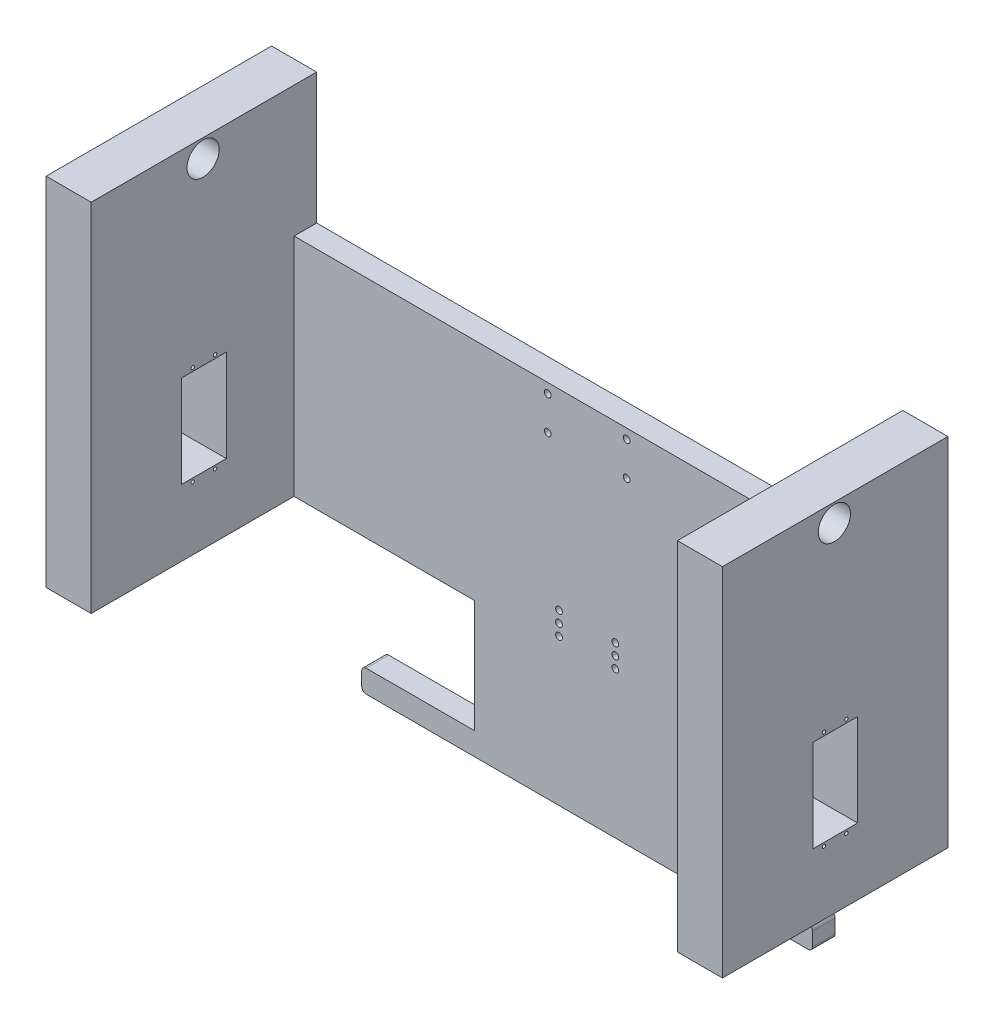
from build123d import *

# Parameters (mm, degrees)
SKETCH1_W           = 300
SKETCH1_H           = 100
BOSS_EXTRUDE1_DEPTH = 10
SKETCH2_W           = 20
SKETCH2_H           = 100
BOSS_EXTRUDE2_DEPTH = 90
SKETCH3_W           = 19.9
SKETCH3_H           = 40.9
SKETCH3_R           = 0.75
CUT_EXTRUDE1_DEPTH  = 321.156211872
SKETCH4_W           = 100
SKETCH4_H           = 10
BOSS_EXTRUDE4_DEPTH = 60
SKETCH6_W           = 200
SKETCH6_H           = 10
BOSS_EXTRUDE5_DEPTH = 10
FILLET1_R           = 2
SKETCH8_W           = 20
SKETCH8_H           = 100
BOSS_EXTRUDE7_DEPTH = 50
BOSS_EXTRUDE9_DEPTH = 300
SKETCH12_W          = 260
SKETCH12_H          = 100
CUT_EXTRUDE4_DEPTH  = 20
SKETCH13_R          = 1.5
CUT_EXTRUDE5_DEPTH  = 207.639783198
SKETCH14_R          = 7.15
CUT_EXTRUDE7_DEPTH  = 335.813380856
SKETCH15_R          = 1.5
CUT_EXTRUDE8_DEPTH  = 212.187120819


with BuildPart() as part:
    # Sketch1 → Boss-Extrude1 (new body)
    with BuildSketch(Plane.XY):
        Rectangle(SKETCH1_W, SKETCH1_H)
    extrude(amount=BOSS_EXTRUDE1_DEPTH)

    # Sketch2 → Boss-Extrude2 (add)
    with BuildSketch(Plane.XY.offset(10)):
        with Locations((-140, 0)):
            Rectangle(SKETCH2_W, SKETCH2_H)
        with Locations((140, 0)):
            Rectangle(SKETCH2_W, SKETCH2_H)
    extrude(amount=BOSS_EXTRUDE2_DEPTH)

    # Sketch3 → Cut-Extrude1 (cut, through all)
    with BuildSketch(Plane.ZY.offset(150)):
        with Locations((50, 0)):
            Rectangle(SKETCH3_W, SKETCH3_H)
        with Locations((45.025, 21.95)):
            Circle(SKETCH3_R)
        with Locations((54.975, 21.95)):
            Circle(SKETCH3_R)
        with Locations((45.025, -21.95)):
            Circle(SKETCH3_R)
        with Locations((54.975, -21.95)):
            Circle(SKETCH3_R)
    extrude(amount=-CUT_EXTRUDE1_DEPTH, mode=Mode.SUBTRACT)

    # Sketch4 → Boss-Extrude4 (add)
    with BuildSketch(Plane.XZ.offset(50)):
        with Locations((0, 5)):
            Rectangle(SKETCH4_W, SKETCH4_H)
    extrude(amount=BOSS_EXTRUDE4_DEPTH)

    # Sketch6 → Boss-Extrude5 (add)
    with BuildSketch(Plane.XZ.offset(110)):
        with Locations((0, 5)):
            Rectangle(SKETCH6_W, SKETCH6_H)
    extrude(amount=-BOSS_EXTRUDE5_DEPTH)

    # Fillet1
    fillet1_edges = [part.edges().sort_by_distance(p)[0] for p in [
        (-100, -110, 5),
        (100, -100, 5),
        (-100, -100, 5),
        (100, -110, 5),
    ]]
    fillet(fillet1_edges, radius=FILLET1_R)

    # Sketch8 → Boss-Extrude7 (add)
    with BuildSketch(Plane(origin=(0, 50, 0), x_dir=(1, 0, 0), z_dir=(0, 1, 0))):
        with Locations((-140, -50)):
            Rectangle(SKETCH8_W, SKETCH8_H)
        with Locations((140, -50)):
            Rectangle(SKETCH8_W, SKETCH8_H)
    extrude(amount=BOSS_EXTRUDE7_DEPTH)

    # Sketch9 → Boss-Extrude9 (add, through all)
    with BuildSketch(Plane.ZY.offset(150)):
        with BuildLine():
            Line((0, 108), (0, 102.5))
            Line((0, 102.5), (48.5, 102.5))
            ThreePointArc((48.5, 102.5), (50, 104), (51.5, 102.5))
            Line((51.5, 102.5), (100, 102.5))
            Line((100, 102.5), (100, 108))
            Line((100, 108), (0, 108))
        make_face()
        with BuildLine():
            Line((0, 102.5), (0, 100))
            Line((0, 100), (100, 100))
            Line((100, 100), (100, 102.5))
            Line((100, 102.5), (51.5, 102.5))
            ThreePointArc((51.5, 102.5), (50, 101), (48.5, 102.5))
            Line((48.5, 102.5), (0, 102.5))
        make_face()
    extrude(amount=-BOSS_EXTRUDE9_DEPTH)

    # Sketch12 → Cut-Extrude4 (cut)
    with BuildSketch(Plane.XZ.offset(-100)):
        with Locations((0, 50)):
            Rectangle(SKETCH12_W, SKETCH12_H)
    extrude(amount=-CUT_EXTRUDE4_DEPTH, mode=Mode.SUBTRACT)

    # Sketch13 → Cut-Extrude5 (cut, through all)
    with BuildSketch(Plane.XY.offset(10)):
        with Locations((12.5, -35)):
            Circle(SKETCH13_R)
        with Locations((12.5, -40)):
            Circle(SKETCH13_R)
        with Locations((12.5, -45)):
            Circle(SKETCH13_R)
        with Locations((-12.5, -35)):
            Circle(SKETCH13_R)
        with Locations((-12.5, -40)):
            Circle(SKETCH13_R)
        with Locations((-12.5, -45)):
            Circle(SKETCH13_R)
    extrude(amount=-CUT_EXTRUDE5_DEPTH, mode=Mode.SUBTRACT)

    # Sketch14 → Cut-Extrude7 (cut, through all)
    with BuildSketch(Plane(origin=(150, 0, 0), x_dir=(0, 0, -1), z_dir=(1, 0, 0))):
        with Locations(Location((-50.372507489, 99.940398802, 0), (0, 0, 90))):
            Circle(SKETCH14_R)
    extrude(amount=-CUT_EXTRUDE7_DEPTH, mode=Mode.SUBTRACT)

    # Sketch15 → Cut-Extrude8 (cut, through all)
    with BuildSketch(Plane(origin=(0, 0, 0), x_dir=(-1, 0, 0), z_dir=(0, 0, -1))):
        with Locations((-17.5, 45.680401999)):
            Circle(SKETCH15_R)
        with Locations((17.5, 45.680401999)):
            Circle(SKETCH15_R)
        with Locations((-17.5, 30.680401999)):
            Circle(SKETCH15_R)
        with Locations((17.5, 30.786051179)):
            Circle(SKETCH15_R)
    extrude(amount=-CUT_EXTRUDE8_DEPTH, mode=Mode.SUBTRACT)


solid = part.part
